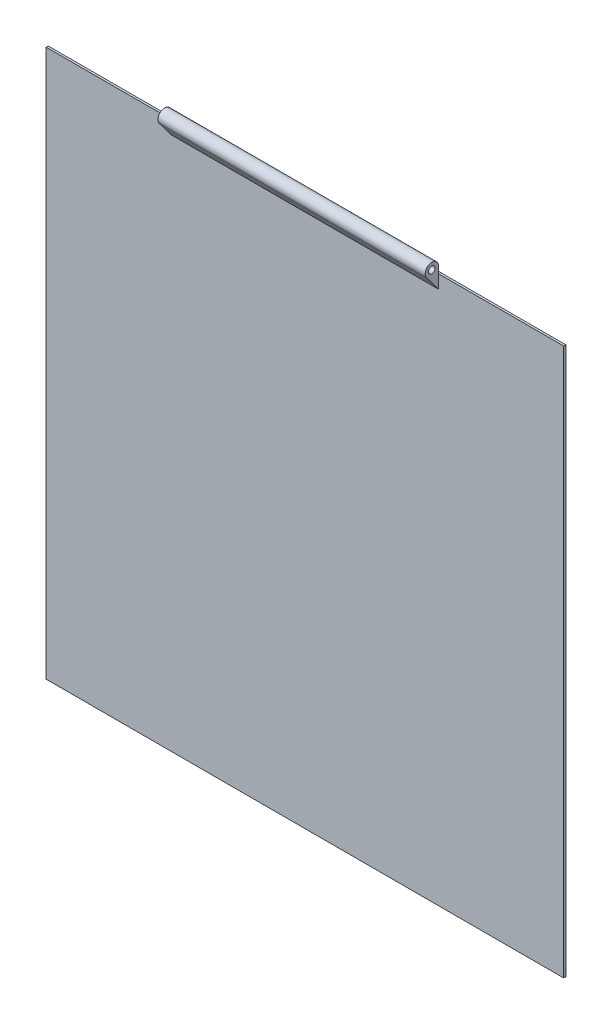
from build123d import *

# Parameters (mm, degrees)
SKETCH1_W           = 387.3
SKETCH1_H           = 409.62
BOSS_EXTRUDE1_DEPTH = 1.5875
SKETCH2_R           = 2.5
BOSS_EXTRUDE3_DEPTH = 100


with BuildPart() as part:
    # Sketch1 → Boss-Extrude1 (new body)
    with BuildSketch(Plane.XY):
        with Locations((0, -204.81)):
            Rectangle(SKETCH1_W, SKETCH1_H)
    extrude(amount=BOSS_EXTRUDE1_DEPTH)

    # Sketch2 → Boss-Extrude3 (add, symmetric)
    with BuildSketch(Plane(origin=(0, 0, 0), x_dir=(0, 0, -1), z_dir=(1, 0, 0))):
        with BuildLine():
            Line((-10.5875, 2), (-1.5875, -10))
            Line((-1.5875, -10), (-1.5875, 5))
            ThreePointArc((-1.5875, 5), (-8.16863883, 9.74341649), (-10.5875, 2))
        make_face()
        with Locations((-6.5875, 5)):
            Circle(SKETCH2_R, mode=Mode.SUBTRACT)
    extrude(amount=BOSS_EXTRUDE3_DEPTH, both=True)


solid = part.part
